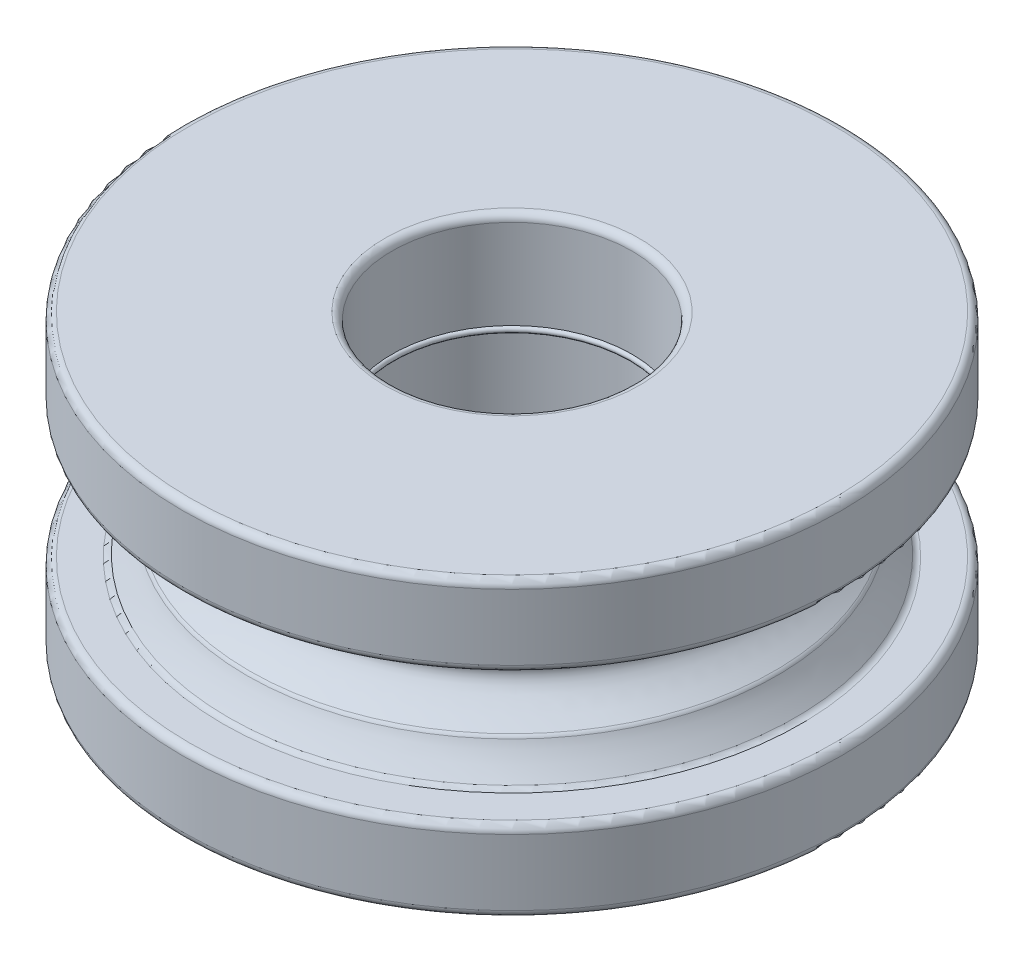
from build123d import *

# Parameters (mm, degrees)
SKETCH2_R          = 4.12
CUT_EXTRUDE1_DEPTH = 35.372954485
CUT_EXTRUDE1_DRAFT = -1.5
FILLET1_R          = 0.5


with BuildPart() as part:
    # Sketch1 → Revolve1 (revolve)
    with BuildSketch(Plane(origin=(0, 0, 0), x_dir=(0, 0, -1), z_dir=(1, 0, 0))):
        with BuildLine():
            Line((-22.5, 0), (0, 0))
            Line((0, 0), (0, 7))
            Line((0, 7), (-8.2, 7))
            Line((-8.2, 7), (-8.2, 13))
            ThreePointArc((-8.2, 13), (-8.021786255, 13.198809857), (-8.2, 13.397619713))
            Line((-8.2, 13.397619713), (-8.2, 15.5))
            Line((-8.2, 15.5), (-8.2, 20))
            Line((-8.2, 20), (-22.5, 20))
            Line((-22.5, 20), (-22.5, 14.5))
            Line((-22.5, 14.5), (-19.5, 14.5))
            add(Edge.make_bspline(
                [(-18.041867892, 12.297751197), (-18.343284326, 13.120109751), (-19.5, 14.5)],
                knots=[0, 0, 0, 1, 1, 1], degree=2, weights=[1, 1.045697504, 1]))
            add(Edge.make_bspline(
                [(-18.041867892, 12.297751197), (-14.830937527, 9.974175575), (-18.041867892, 7.650599954)],
                knots=[0, 0, 0, 1, 1, 1], degree=2, weights=[1, 1.840664215, 1]))
            add(Edge.make_bspline(
                [(-19.5, 5.5), (-18.343284326, 6.879890249), (-18.041867892, 7.650599954)],
                knots=[0, 0, 0, 1, 1, 1], degree=2, weights=[1, 1.045697504, 1]))
            Line((-19.5, 5.5), (-22.5, 5.5))
            Line((-22.5, 5.5), (-22.5, 0))
        make_face()
    revolve(axis=Axis((0, 39.130434783, 0), (0, -1, 0)))


with BuildPart() as cut_extrude1_tool:
    # Sketch2 → Cut-Extrude1 (with draft: the straight prism first)
    with BuildSketch(Plane.XZ.offset(-7)):
        Circle(SKETCH2_R)
    extrude(amount=CUT_EXTRUDE1_DEPTH)
    # Cut-Extrude1: the draft: its side faces are tilted about the plane it starts from
    cut_extrude1_sides = [cut_extrude1_tool.faces().sort_by_distance(p)[0] for p in [
        (-4.12, -10.686477242, 0),
    ]]
    draft(cut_extrude1_sides, Plane.XZ.offset(-7), CUT_EXTRUDE1_DRAFT)


with BuildPart() as part_1:
    add(part.part)

    # Cut-Extrude1: cut by cut_extrude1_tool
    add(cut_extrude1_tool.part, mode=Mode.SUBTRACT)

    # Fillet1
    fillet1_edges = [part_1.edges().sort_by_distance(p)[0] for p in [
        (-4.303301451, 0, 0),
        (0, 20, -8.2),
        (0, 20, -22.5),
        (0, 5.5, -22.5),
        (0, 14.5, -22.5),
        (0, 5.5, -19.5),
        (0, 0, -22.5),
        (0, 7.650599954, -18.041867892),
        (0, 12.297751197, -18.041867892),
        (0, 14.5, -19.5),
    ]]
    fillet(fillet1_edges, radius=FILLET1_R)


solid = part_1.part
